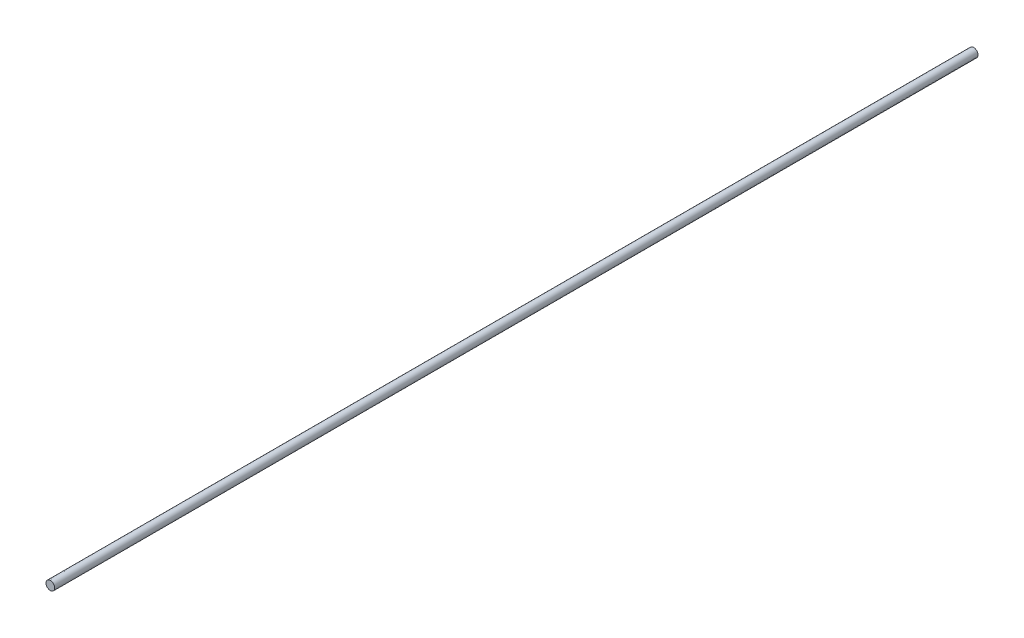
from build123d import *

# Parameters (mm, degrees)
SKETCH2_R           = 4
BOSS_EXTRUDE1_DEPTH = 422.5


with BuildPart() as part:
    # Sketch2 → Boss-Extrude1 (new, symmetric)
    with BuildSketch(Plane.XY):
        Circle(SKETCH2_R)
    extrude(amount=BOSS_EXTRUDE1_DEPTH, both=True)


solid = part.part
